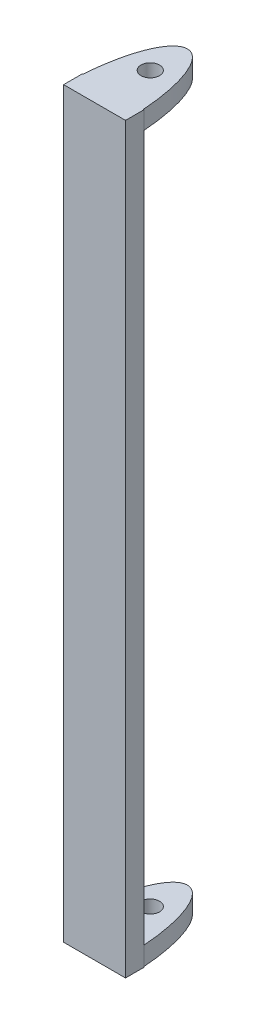
from build123d import *

# Parameters (mm, degrees)
BOSS_EXTRUDE1_DEPTH = 3
SKETCH2_R           = 1.5
CUT_EXTRUDE1_DEPTH  = 19.275667036
SKETCH3_W           = 10
SKETCH3_H           = 120
BOSS_EXTRUDE2_DEPTH = 3


with BuildPart() as part:
    # Sketch1 → Boss-Extrude1 (new body)
    with BuildSketch(Plane(origin=(0, 0, 0), x_dir=(1, 0, 0), z_dir=(0, 1, 0))):
        with BuildLine():
            Line((0, 0), (10, 0))
            add(Edge.make_bspline(
                [(10, 0), (10, 15), (5, 15), (0, 15), (0, 0)],
                knots=[4.71238898, 4.71238898, 4.71238898, 6.283185307, 6.283185307, 7.853981634, 7.853981634, 7.853981634], degree=2, weights=[1, 0.707106781, 1, 0.707106781, 1]))
        make_face()
    boss_extrude1 = extrude(amount=BOSS_EXTRUDE1_DEPTH)

    # Sketch2 → Cut-Extrude1 (cut, through all)
    with BuildSketch(Plane(origin=(0, 3, 0), x_dir=(1, 0, 0), z_dir=(0, 1, 0))):
        with Locations(Location((5, 9, 0), (0, 0, 270))):
            Circle(SKETCH2_R)
    cut_extrude1 = extrude(amount=-CUT_EXTRUDE1_DEPTH, mode=Mode.SUBTRACT)

    # Sketch3 → Boss-Extrude2 (add)
    with BuildSketch(Plane.XY):
        with Locations((5, -57)):
            Rectangle(SKETCH3_W, SKETCH3_H)
    extrude(amount=-BOSS_EXTRUDE2_DEPTH)

    # Mirror1: Boss-Extrude1, Cut-Extrude1 across plane
    add(boss_extrude1.mirror(Plane.ZX.offset(-57)))
    add(cut_extrude1.mirror(Plane.ZX.offset(-57)), mode=Mode.SUBTRACT)


solid = part.part
